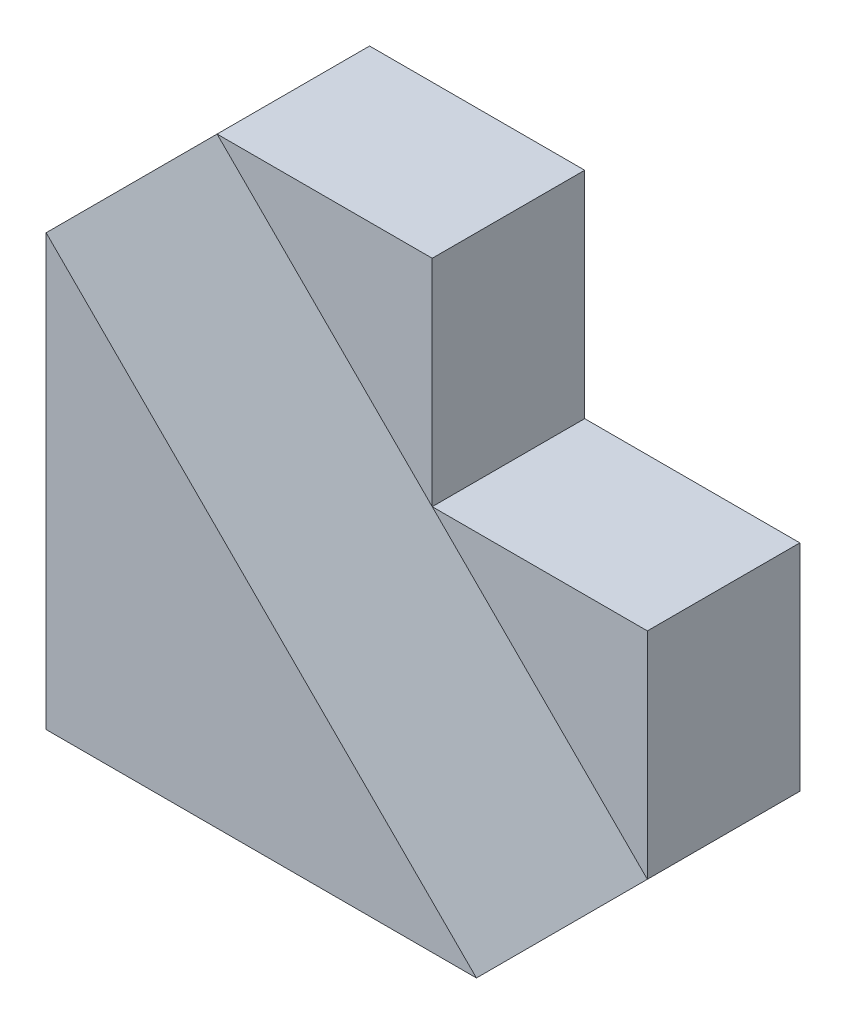
from build123d import *

# Parameters (mm, degrees)
BOSS_EXTRUDE3_DEPTH = 37.581213244
BOSS_EXTRUDE4_DEPTH = 17.71872424


with BuildPart() as part:
    # Sketch1 → Boss-Extrude3 (new body)
    with BuildSketch(Plane.XY):
        Polygon((-21.245059289, 35.57312253), (-21.245059289, -14.42687747), (28.754940711, -14.42687747), align=None)
    extrude(amount=BOSS_EXTRUDE3_DEPTH)

    # Sketch1<9> → Boss-Extrude4 (add)
    with BuildSketch(Plane.XY):
        Polygon((3.754940711, 35.57312253), (-21.245059289, 35.57312253), (3.754940711, 10.57312253), align=None)
        Polygon((28.754940711, 10.57312253), (3.754940711, 10.57312253), (28.754940711, -14.42687747), align=None)
    extrude(amount=BOSS_EXTRUDE4_DEPTH)


solid = part.part
